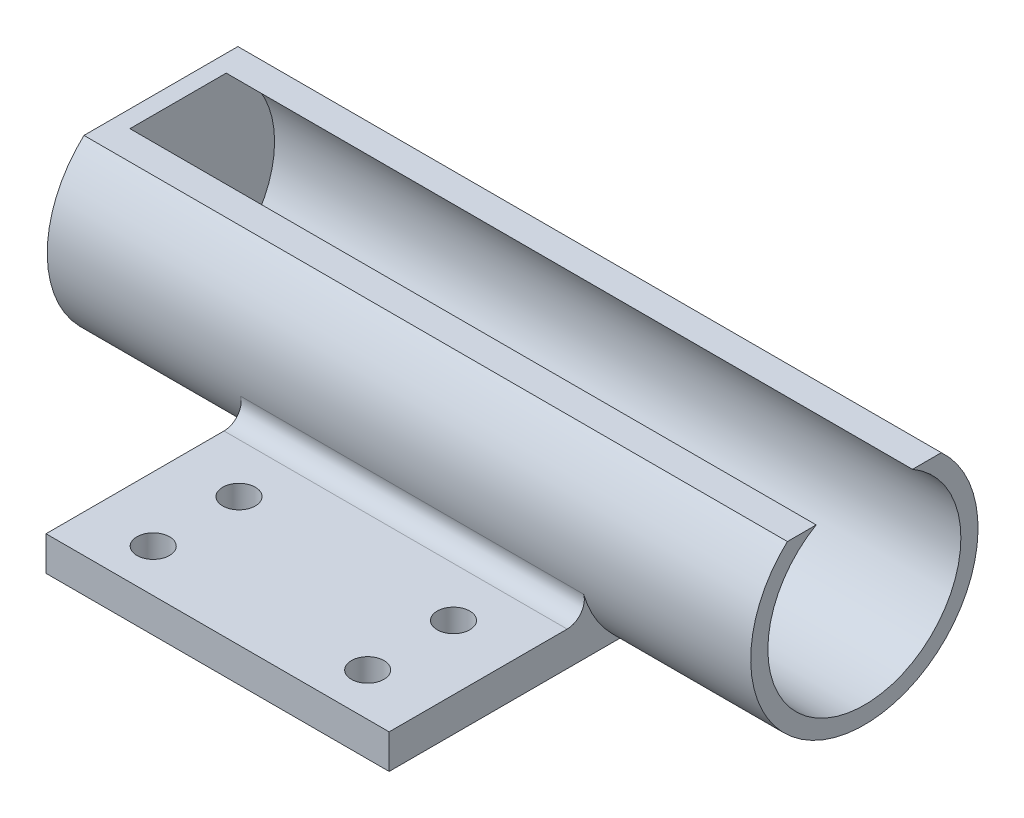
from build123d import *

# Parameters (mm, degrees)
SKETCH1_W           = 40
SKETCH1_H           = 20
SKETCH1_R           = 1.9
BOSS_EXTRUDE1_DEPTH = 4
BOSS_EXTRUDE2_DEPTH = 40
BOSS_EXTRUDE3_START = 20
BOSS_EXTRUDE3_DEPTH = 20
BOSS_EXTRUDE4_DEPTH = 20
FILLET1_R           = 2
BOSS_EXTRUDE5_DEPTH = 2


with BuildPart() as part:
    # Sketch1 → Boss-Extrude1 (new body)
    with BuildSketch(Plane(origin=(0, 0, 0), x_dir=(1, 0, 0), z_dir=(0, 1, 0))):
        with Locations((12.5, 5)):
            Rectangle(SKETCH1_W, SKETCH1_H)
        with Locations(Location((0, 0, 0), (0, 0, 270))):
            Circle(SKETCH1_R, mode=Mode.SUBTRACT)
        with Locations(Location((0, 10, 0), (0, 0, 270))):
            Circle(SKETCH1_R, mode=Mode.SUBTRACT)
        with Locations(Location((25, 10, 0), (0, 0, 90))):
            Circle(SKETCH1_R, mode=Mode.SUBTRACT)
        with Locations(Location((25, 0, 0), (0, 0, 90))):
            Circle(SKETCH1_R, mode=Mode.SUBTRACT)
    extrude(amount=BOSS_EXTRUDE1_DEPTH)

    # Sketch3 → Boss-Extrude2 (add)
    with BuildSketch(Plane(origin=(32.5, 0, 0), x_dir=(0, 0, -1), z_dir=(1, 0, 0))):
        with BuildLine():
            ThreePointArc((22, 0), (20.159285507, 1.837900533), (18.713106366, 4))
            Line((18.713106366, 4), (15, 4))
            Line((15, 4), (15, 0))
            Line((15, 0), (22, 0))
        make_face()
        with BuildLine():
            Line((24.783941732, 20), (21.424248589, 20))
            ThreePointArc((21.424248589, 20), (30.396427812, -3), (39.368607034, 20))
            Line((39.368607034, 20), (36.008913892, 20))
            ThreePointArc((36.008913892, 20), (30.396427812, -1), (24.783941732, 20))
        make_face()
    extrude(amount=-BOSS_EXTRUDE2_DEPTH)

    # Sketch4 → Boss-Extrude3 (add)
    with BuildSketch(Plane(origin=(32.5, 0, 0), x_dir=(0, 0, -1), z_dir=(1, 0, 0)).offset(BOSS_EXTRUDE3_START)):
        with BuildLine():
            Line((24.783941732, 20), (21.424248589, 20))
            ThreePointArc((21.424248589, 20), (30.396427812, -3), (39.368607034, 20))
            Line((39.368607034, 20), (36.008913892, 20))
            ThreePointArc((36.008913892, 20), (30.396427812, -1), (24.783941732, 20))
        make_face()
    extrude(amount=-BOSS_EXTRUDE3_DEPTH)

    # Sketch5 → Boss-Extrude4 (add)
    with BuildSketch(Plane.ZY.offset(7.5)):
        with BuildLine():
            Line((-21.424248589, 20), (-24.783941732, 20))
            ThreePointArc((-24.783941732, 20), (-30.396427812, -1), (-36.008913892, 20))
            Line((-36.008913892, 20), (-39.368607034, 20))
            ThreePointArc((-39.368607034, 20), (-30.396427812, -3), (-21.424248589, 20))
        make_face()
    extrude(amount=BOSS_EXTRUDE4_DEPTH)

    # Fillet1
    fillet1_edges = [part.edges().sort_by_distance(p)[0] for p in [
        (12.5, 4, -18.713106366),
    ]]
    fillet(fillet1_edges, radius=FILLET1_R)

    # Sketch7 → Boss-Extrude5 (add)
    with BuildSketch(Plane.ZY.offset(27.5)):
        with BuildLine():
            Line((-39.368607034, 20), (-21.424248589, 20))
            ThreePointArc((-21.424248589, 20), (-30.396427812, -3), (-39.368607034, 20))
        make_face()
    extrude(amount=BOSS_EXTRUDE5_DEPTH)


solid = part.part
